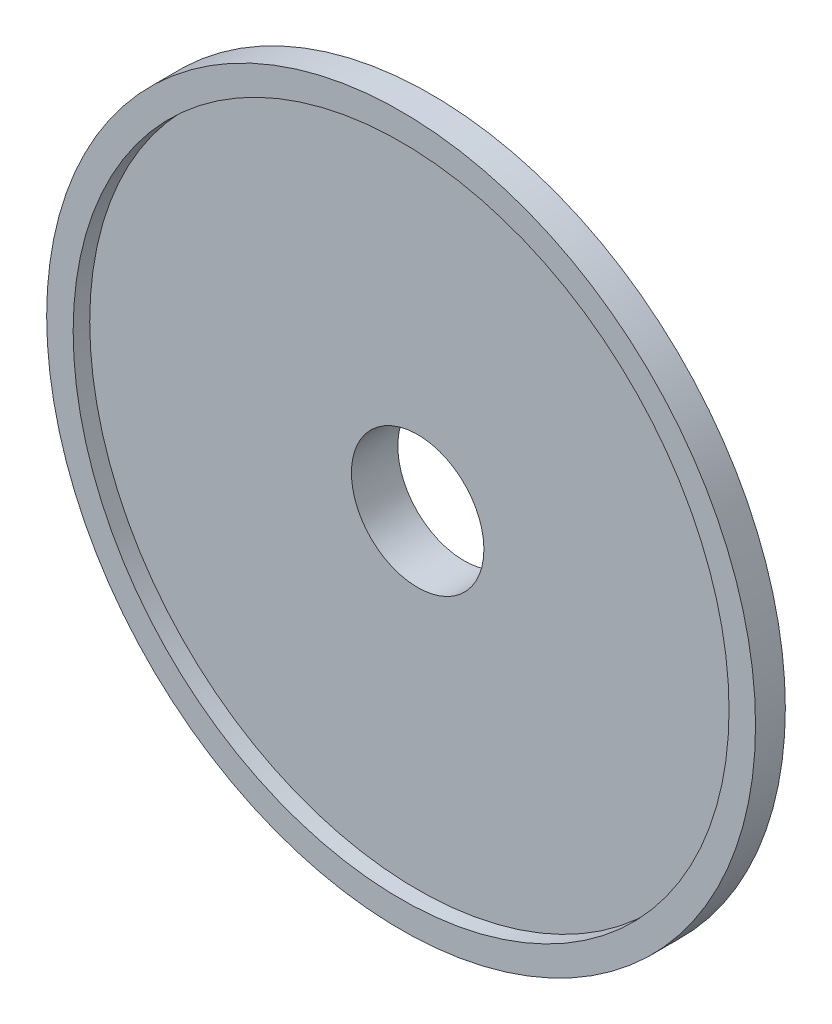
from build123d import *

# Parameters (mm, degrees)
SKETCH1_R           = 53.5
BOSS_EXTRUDE1_DEPTH = 14.5
SKETCH2_R           = 49.5
CUT_EXTRUDE1_DEPTH  = 2.5
SKETCH3_R           = 10
CUT_EXTRUDE3_DEPTH  = 14.5
SKETCH6_R           = 53.5
SKETCH6_R_2         = 30
CUT_EXTRUDE8_DEPTH  = 10
SKETCH7_R           = 27.8
CUT_EXTRUDE9_DEPTH  = 5


with BuildPart() as part:
    # Sketch1 → Boss-Extrude1 (new body)
    with BuildSketch(Plane.XY):
        with Locations(Location((0, 0, 0), (0, 0, 180))):
            Circle(SKETCH1_R)
    extrude(amount=BOSS_EXTRUDE1_DEPTH)

    # Sketch2 → Cut-Extrude1 (cut)
    with BuildSketch(Plane.XY.offset(14.5)):
        Circle(SKETCH2_R)
    extrude(amount=-CUT_EXTRUDE1_DEPTH, mode=Mode.SUBTRACT)

    # Sketch3 → Cut-Extrude3 (cut)
    with BuildSketch(Plane.XY.offset(12)):
        Circle(SKETCH3_R)
    extrude(amount=-CUT_EXTRUDE3_DEPTH, mode=Mode.SUBTRACT)

    # Sketch6 → Cut-Extrude8 (cut)
    with BuildSketch(Plane(origin=(0, 0, 0), x_dir=(-1, 0, 0), z_dir=(0, 0, -1))):
        Circle(SKETCH6_R)
        Circle(SKETCH6_R_2, mode=Mode.SUBTRACT)
    extrude(amount=-CUT_EXTRUDE8_DEPTH, mode=Mode.SUBTRACT)

    # Sketch7 → Cut-Extrude9 (cut)
    with BuildSketch(Plane(origin=(0, 0, 0), x_dir=(-1, 0, 0), z_dir=(0, 0, -1))):
        Circle(SKETCH7_R)
    extrude(amount=-CUT_EXTRUDE9_DEPTH, mode=Mode.SUBTRACT)


solid = part.part
